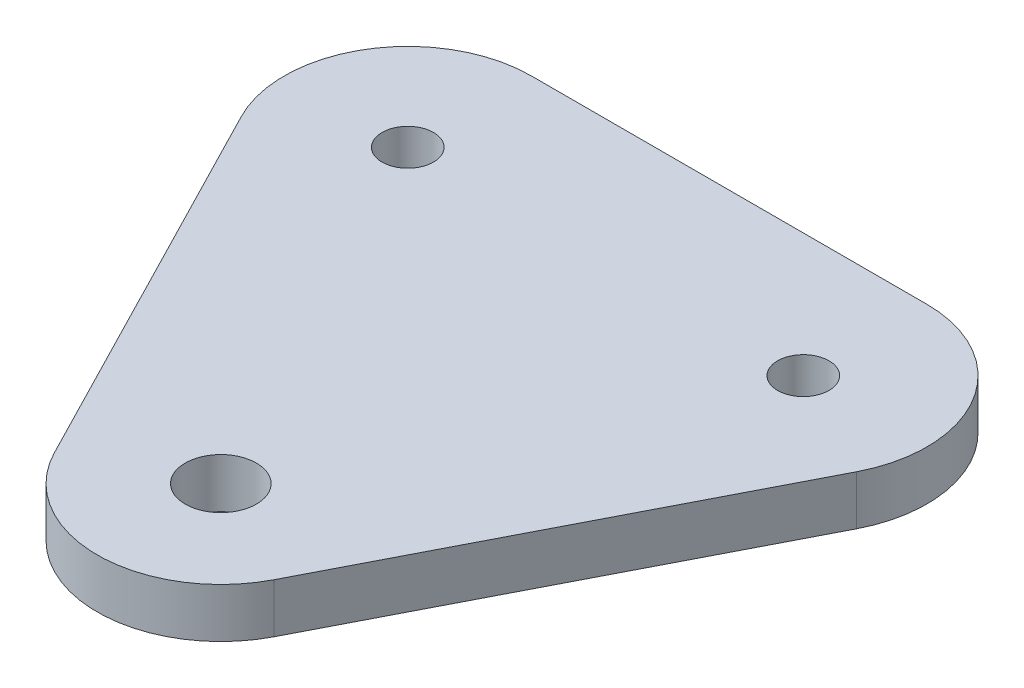
from build123d import *

# Parameters (mm, degrees)
SKETCH1_R           = 2.6
SKETCH1_R_2         = 3.6
BOSS_EXTRUDE1_DEPTH = 5


with BuildPart() as part:
    # Sketch1 → Boss-Extrude1 (new body)
    with BuildSketch(Plane(origin=(0, 0, 0), x_dir=(1, 0, 0), z_dir=(0, 1, 0))):
        with BuildLine():
            Line((-31.117126255, 8.600085423), (-11.115122128, -30.309917119))
            ThreePointArc((-11.115122128, -30.309917119), (0.002513408, -37.095067694), (11.119596019, -30.309011222))
            Line((11.119596019, -30.309011222), (31.117591892, 8.60099132))
            ThreePointArc((31.117591892, 8.60099132), (30.669449235, 20.827449945), (20, 26.814934838))
            Line((20, 26.814934838), (-20, 26.814934838))
            ThreePointArc((-20, 26.814934838), (-30.669714562, 20.82701524), (-31.117126255, 8.600085423))
        make_face()
        with Locations(Location((-20, 14.314934838, 0), (0, 0, 270))):
            Circle(SKETCH1_R, mode=Mode.SUBTRACT)
        with Locations(Location((20, 14.314934838, 0), (0, 0, 270))):
            Circle(SKETCH1_R, mode=Mode.SUBTRACT)
        with Locations(Location((0.002004127, -24.595067704, 0), (0, 0, 270))):
            Circle(SKETCH1_R_2, mode=Mode.SUBTRACT)
    extrude(amount=BOSS_EXTRUDE1_DEPTH)


solid = part.part
